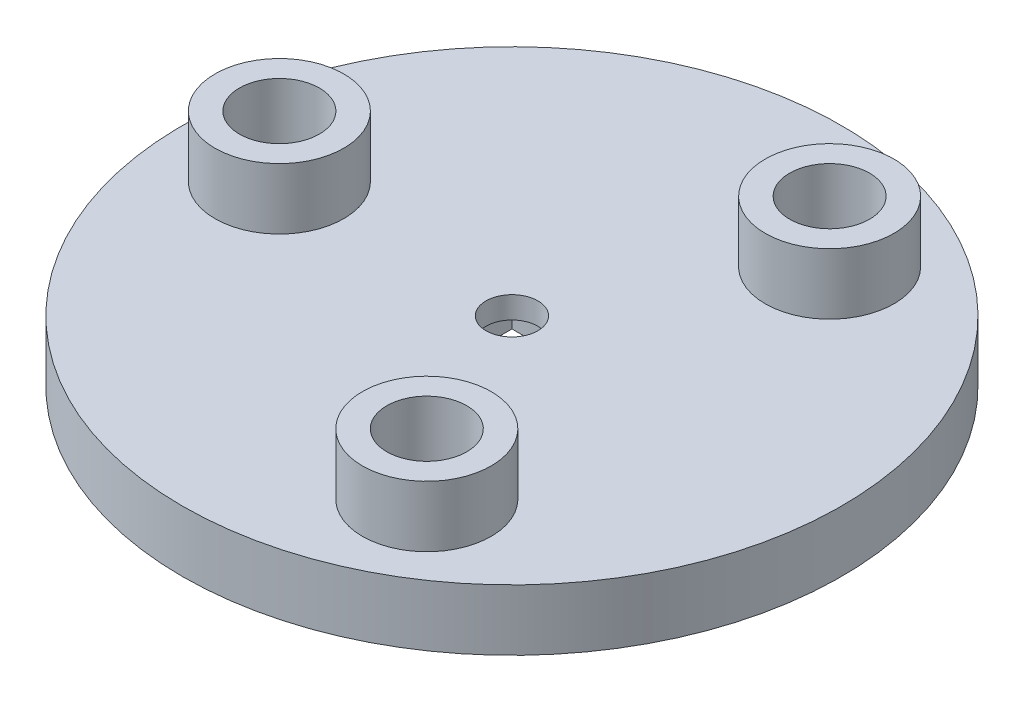
from build123d import *

# Parameters (mm, degrees)
SKETCH2_R           = 27
SKETCH2_R_2         = 2.125
BOSS_EXTRUDE2_DEPTH = 10
SKETCH3_R           = 3.275
CUT_EXTRUDE1_DEPTH  = 7.5
CUT_EXTRUDE2_START  = -5
SKETCH4_R           = 27
SKETCH4_R_2         = 5.275
CUT_EXTRUDE2_DEPTH  = 5
SKETCH5_W           = 8.128
SKETCH5_H           = 8.13
CUT_EXTRUDE3_DEPTH  = 3.2


with BuildPart() as part:
    # Sketch2 → Boss-Extrude2 (new body)
    with BuildSketch(Plane(origin=(0, 0, 0), x_dir=(1, 0, 0), z_dir=(0, 1, 0))):
        with Locations(Location((0, 0, 0), (0, 0, 270))):
            Circle(SKETCH2_R)
        with Locations(Location((0, 0, 0), (0, 0, 270))):
            Circle(SKETCH2_R_2, mode=Mode.SUBTRACT)
    extrude(amount=BOSS_EXTRUDE2_DEPTH)

    # Sketch3 → Cut-Extrude1 (cut)
    with BuildSketch(Plane.XZ.offset(-10)):
        with Locations(Location((9.52625, -16.499949006, 0), (0, 0, 270))):
            Circle(SKETCH3_R)
        with Locations(Location((9.52625, 16.499949006, 0), (0, 0, 270))):
            Circle(SKETCH3_R)
        with Locations(Location((-19.0525, 0, 0), (0, 0, 270))):
            Circle(SKETCH3_R)
    extrude(amount=CUT_EXTRUDE1_DEPTH, mode=Mode.SUBTRACT)

    # Sketch4 → Cut-Extrude2 (cut)
    with BuildSketch(Plane(origin=(0, 10, 0), x_dir=(1, 0, 0), z_dir=(0, 1, 0)).offset(CUT_EXTRUDE2_START)):
        with Locations(Location((0, 0, 0), (0, 0, 270))):
            Circle(SKETCH4_R)
        with Locations(Location((-19.0525, 0, 0), (0, 0, 270))):
            Circle(SKETCH4_R_2, mode=Mode.SUBTRACT)
        with Locations(Location((9.52625, -16.499949006, 0), (0, 0, 270))):
            Circle(SKETCH4_R_2, mode=Mode.SUBTRACT)
        with Locations(Location((9.52625, 16.499949006, 0), (0, 0, 270))):
            Circle(SKETCH4_R_2, mode=Mode.SUBTRACT)
    extrude(amount=CUT_EXTRUDE2_DEPTH, mode=Mode.SUBTRACT)

    # Sketch5 → Cut-Extrude3 (cut)
    with BuildSketch(Plane.XZ):
        Rectangle(SKETCH5_W, SKETCH5_H)
    extrude(amount=-CUT_EXTRUDE3_DEPTH, mode=Mode.SUBTRACT)


solid = part.part
